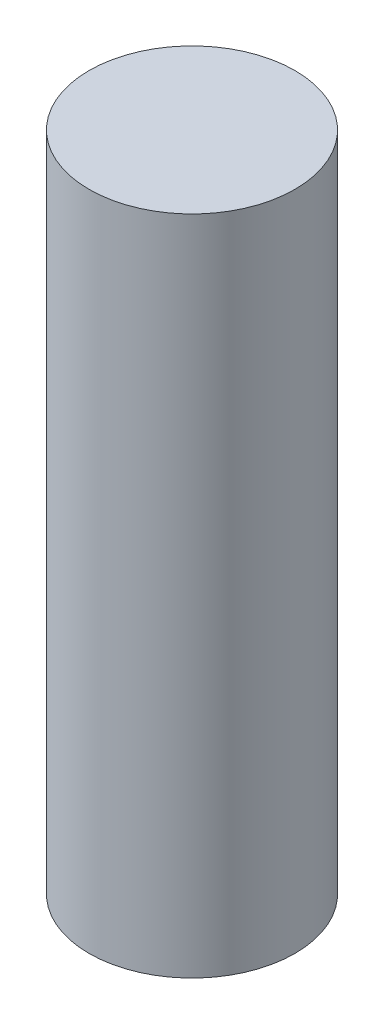
from build123d import *

# Parameters (mm, degrees)
SKETCH_1_R      = 7
EXTRUDE_1_DEPTH = 45


with BuildPart() as part:
    # 草图1 → 凸台-拉伸1 (new body)
    with BuildSketch(Plane(origin=(0, 0, 0), x_dir=(1, 0, 0), z_dir=(0, 1, 0))):
        with Locations(Location((0, 0, 0), (0, 0, 90))):
            Circle(SKETCH_1_R)
    extrude(amount=EXTRUDE_1_DEPTH)


solid = part.part
